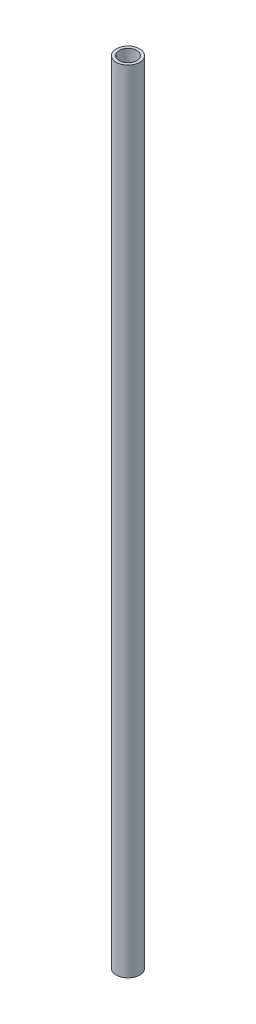
from build123d import *

# Parameters (mm, degrees)
SKETCH2_R   = 4
SKETCH2_R_2 = 3


with BuildPart() as part:
    # Sweep1: sweep along a path in Sketch1
    with BuildLine(Plane.XY) as sweep1_path:
        Line((0, 0), (0, 270))
    # Sketch2 → Sweep1 (sweep)
    with BuildSketch(Plane(origin=(0, 0, 0), x_dir=(1, 0, 0), z_dir=(0, 1, 0))):
        Circle(SKETCH2_R)
        Circle(SKETCH2_R_2, mode=Mode.SUBTRACT)
    sweep(path=sweep1_path.line)


solid = part.part
